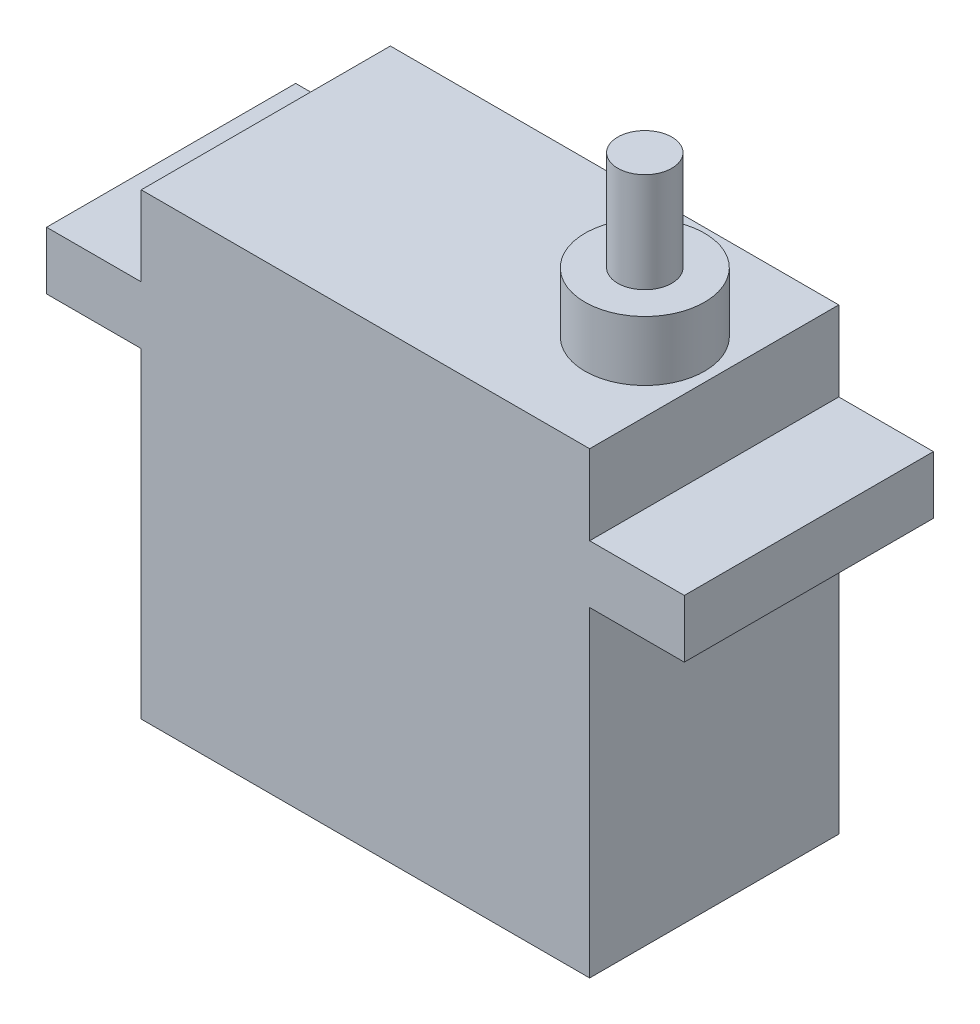
from build123d import *

# Parameters (mm, degrees)
SKETCH_1_W          = 32
SKETCH_1_H          = 12.5
EXTRUDE_1_DEPTH     = 23
SKETCH_3_W          = 4.75
SKETCH_3_H          = 12.5
CUT_EXTRUDE_2_DEPTH = 4
SKETCH_8_W          = 4.75
SKETCH_8_H          = 12.5
CUT_EXTRUDE_3_DEPTH = 16.1
SKETCH_9_R          = 3
EXTRUDE_2_DEPTH     = 3
SKETCH_10_R         = 1.356770986
EXTRUDE_3_DEPTH     = 5


with BuildPart() as part:
    # 草图1 → 凸台-拉伸1 (new body)
    with BuildSketch(Plane(origin=(0, 0, 0), x_dir=(1, 0, 0), z_dir=(0, 1, 0))):
        Rectangle(SKETCH_1_W, SKETCH_1_H)
    extrude(amount=EXTRUDE_1_DEPTH)

    # 草图3 → 切除-拉伸2 (cut)
    with BuildSketch(Plane(origin=(0, 23, 0), x_dir=(1, 0, 0), z_dir=(0, 1, 0))):
        with Locations((-13.625, 0)):
            Rectangle(SKETCH_3_W, SKETCH_3_H)
        with Locations((13.625, 0)):
            Rectangle(SKETCH_3_W, SKETCH_3_H)
    extrude(amount=-CUT_EXTRUDE_2_DEPTH, mode=Mode.SUBTRACT)

    # 草图8 → 切除-拉伸3 (cut)
    with BuildSketch(Plane.XZ):
        with Locations((13.625, 0)):
            Rectangle(SKETCH_8_W, SKETCH_8_H)
        with Locations((-13.625, 0)):
            Rectangle(SKETCH_8_W, SKETCH_8_H)
    extrude(amount=-CUT_EXTRUDE_3_DEPTH, mode=Mode.SUBTRACT)

    # 草图9 → 凸台-拉伸2 (add)
    with BuildSketch(Plane(origin=(0, 23, 0), x_dir=(1, 0, 0), z_dir=(0, 1, 0))):
        with Locations(Location((7.766955593, 0, 0), (0, 0, 270))):
            Circle(SKETCH_9_R)
    extrude(amount=EXTRUDE_2_DEPTH)

    # 草图10 → 凸台-拉伸3 (add)
    with BuildSketch(Plane(origin=(0, 26, 0), x_dir=(1, 0, 0), z_dir=(0, 1, 0))):
        with Locations(Location((7.766955593, 0, 0), (0, 0, 270))):
            Circle(SKETCH_10_R)
    extrude(amount=EXTRUDE_3_DEPTH)


solid = part.part
